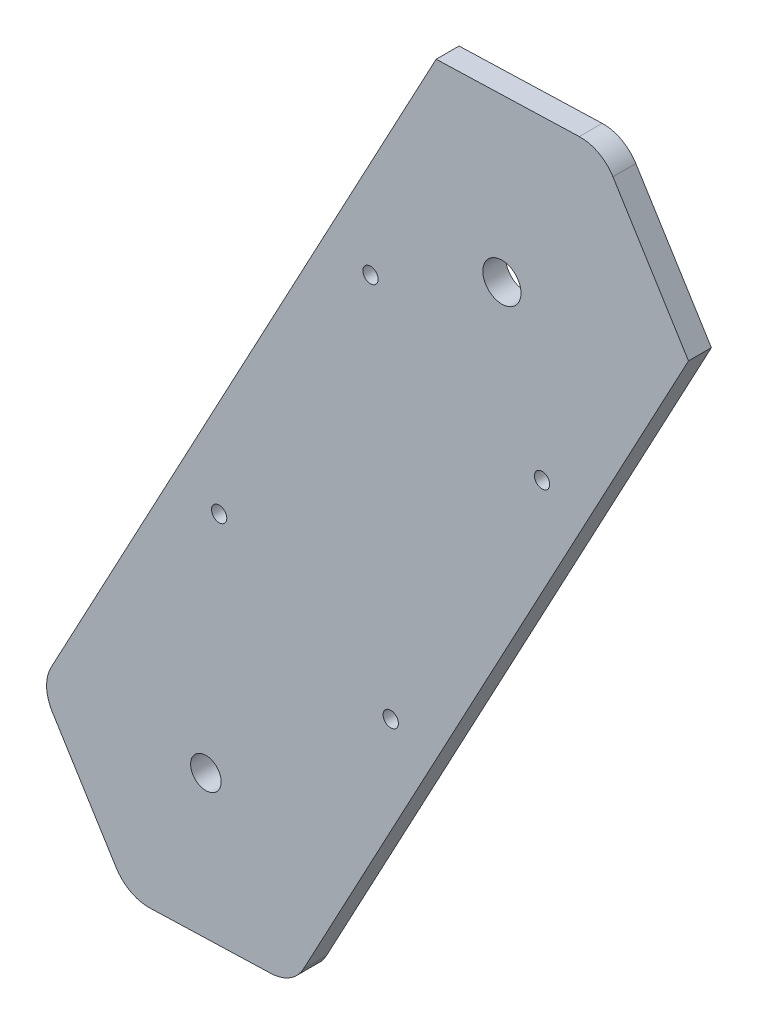
from build123d import *

# Parameters (mm, degrees)
SKETCH1_R           = 2
SKETCH1_R_2         = 5
SKETCH1_R_3         = 4
BOSS_EXTRUDE1_DEPTH = 6


with BuildPart() as part:
    # Sketch1 → Boss-Extrude1 (new body)
    with BuildSketch(Plane.XY):
        with BuildLine():
            Line((-91.133667709, 81.856650449), (-59.395664216, 82.872754588))
            ThreePointArc((-59.395664216, 82.872754588), (-54.441095215, 84.371809376), (-50.89983999, 88.147313406))
            Line((-50.89983999, 88.147313406), (49.994476852, 276.580618392))
            Line((49.994476852, 276.580618392), (30.200235155, 308.463550017))
            ThreePointArc((30.200235155, 308.463550017), (26.424731126, 312.004805242), (21.384421112, 313.183870214))
            Line((21.384421112, 313.183870214), (-16.124128471, 311.983019868))
            Line((-16.124128471, 311.983019868), (-117.018445312, 123.549714881))
            ThreePointArc((-117.018445312, 123.549714881), (-118.197510284, 118.509404867), (-116.698455495, 113.554835867))
            Line((-116.698455495, 113.554835867), (-99.949481752, 86.576970646))
            ThreePointArc((-99.949481752, 86.576970646), (-96.173977723, 83.035715421), (-91.133667709, 81.856650449))
        make_face()
        with Locations((11.628148729, 230.348497445)):
            Circle(SKETCH1_R, mode=Mode.SUBTRACT)
        with Locations((1.104829999, 270.012836125)):
            Circle(SKETCH1_R_2, mode=Mode.SUBTRACT)
        with Locations((-33.33250289, 254.422130449)):
            Circle(SKETCH1_R, mode=Mode.SUBTRACT)
        with Locations((-28.022540924, 156.295659484)):
            Circle(SKETCH1_R, mode=Mode.SUBTRACT)
        with Locations((-72.983192543, 180.369292488)):
            Circle(SKETCH1_R, mode=Mode.SUBTRACT)
        with Locations((-76.464627777, 119.845498823)):
            Circle(SKETCH1_R_3, mode=Mode.SUBTRACT)
    extrude(amount=BOSS_EXTRUDE1_DEPTH)


solid = part.part
